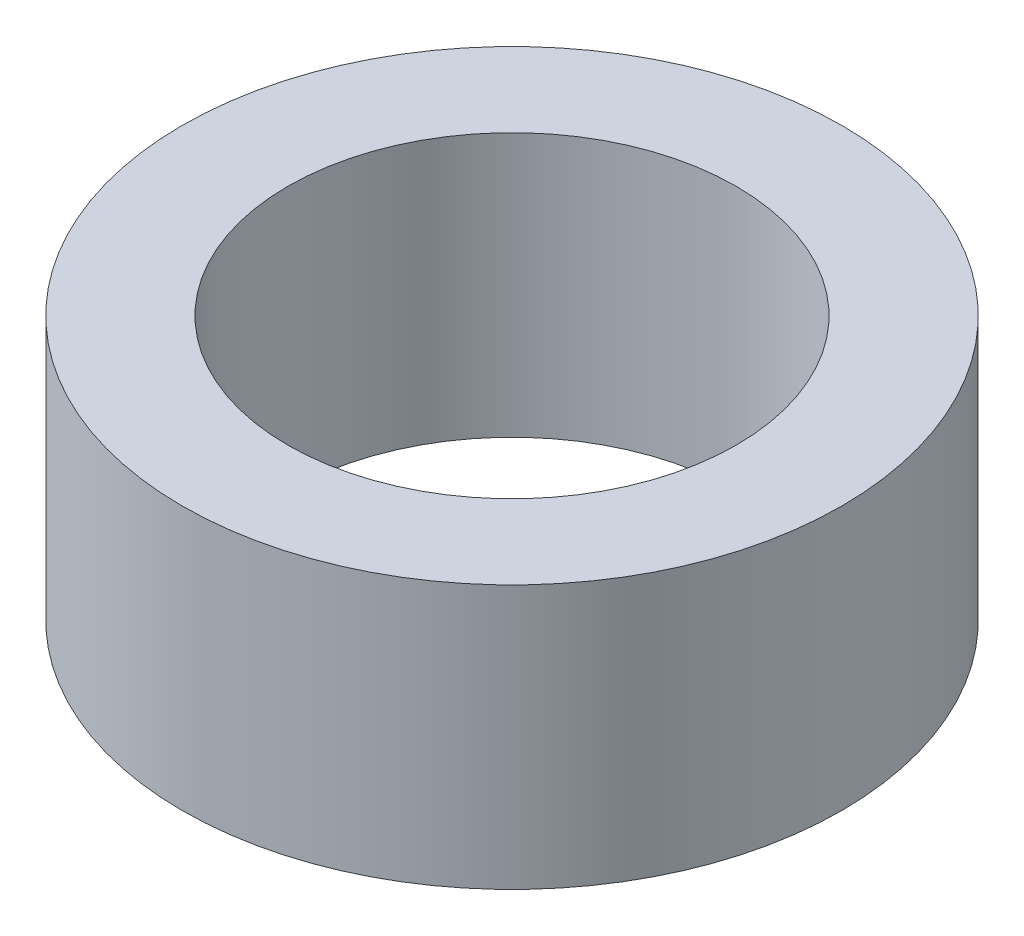
from build123d import *

# Parameters (mm, degrees)
SKETCH1_R           = 3.175
SKETCH1_R_2         = 2.159
BOSS_EXTRUDE1_DEPTH = 2.54


with BuildPart() as part:
    # Sketch1 → Boss-Extrude1 (new body)
    with BuildSketch(Plane(origin=(0, 0, 0), x_dir=(1, 0, 0), z_dir=(0, 1, 0))):
        Circle(SKETCH1_R)
        Circle(SKETCH1_R_2, mode=Mode.SUBTRACT)
    extrude(amount=BOSS_EXTRUDE1_DEPTH)


solid = part.part
